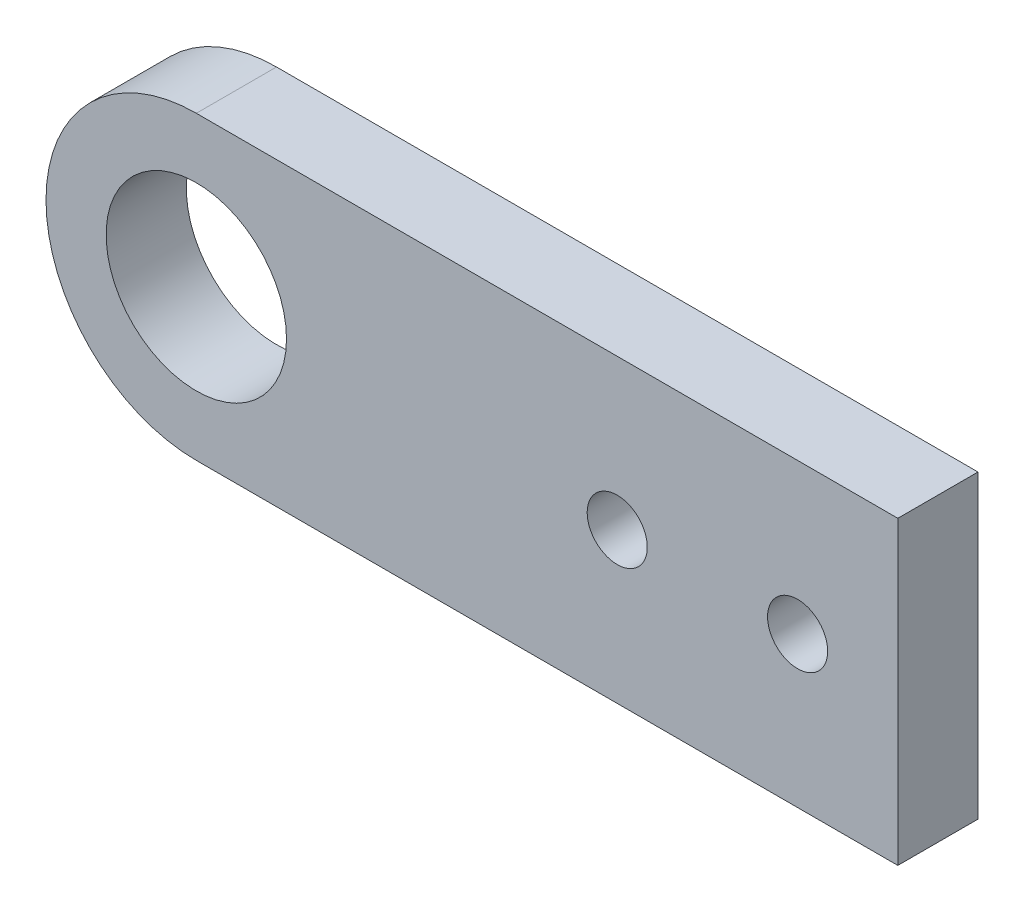
from build123d import *

# Parameters (mm, degrees)
BOSS_EXTRUDE1_DEPTH   = 8
CUT_EXTRUDE1_REACH    = 78.577
SKETCH2_R             = 9
F_6_0MM_DOWEL_HOLE1_D = 6


with BuildPart() as part:
    # Sketch1 → Boss-Extrude1 (new body)
    with BuildSketch(Plane.XY):
        with BuildLine():
            Line((0, 0), (70, 0))
            Line((70, 0), (70, 30))
            Line((70, 30), (0, 30))
            ThreePointArc((0, 30), (-15, 15), (0, 0))
        make_face()
    extrude(amount=BOSS_EXTRUDE1_DEPTH)

    # Sketch2 → Cut-Extrude1 (cut, up to next)
    with BuildSketch(Plane.XY.offset(8), mode=Mode.PRIVATE) as cut_extrude1_sk1:
        with Locations((0, 15)):
            Circle(SKETCH2_R)
    cut_extrude1_tool1 = extrude(cut_extrude1_sk1.sketch, amount=-CUT_EXTRUDE1_REACH, mode=Mode.PRIVATE) & part.part
    add(cut_extrude1_tool1.solids().sort_by_distance((0, 15, 8))[0], mode=Mode.SUBTRACT)

    # Ø6.0mm Dowel Hole1 (through all)
    with Locations(Plane(origin=(0, 0, 0), x_dir=(-1, 0, 0), z_dir=(0, 0, -1))):
        with Locations((-42, 15), (-60, 15)):
            Hole(F_6_0MM_DOWEL_HOLE1_D / 2)


solid = part.part
